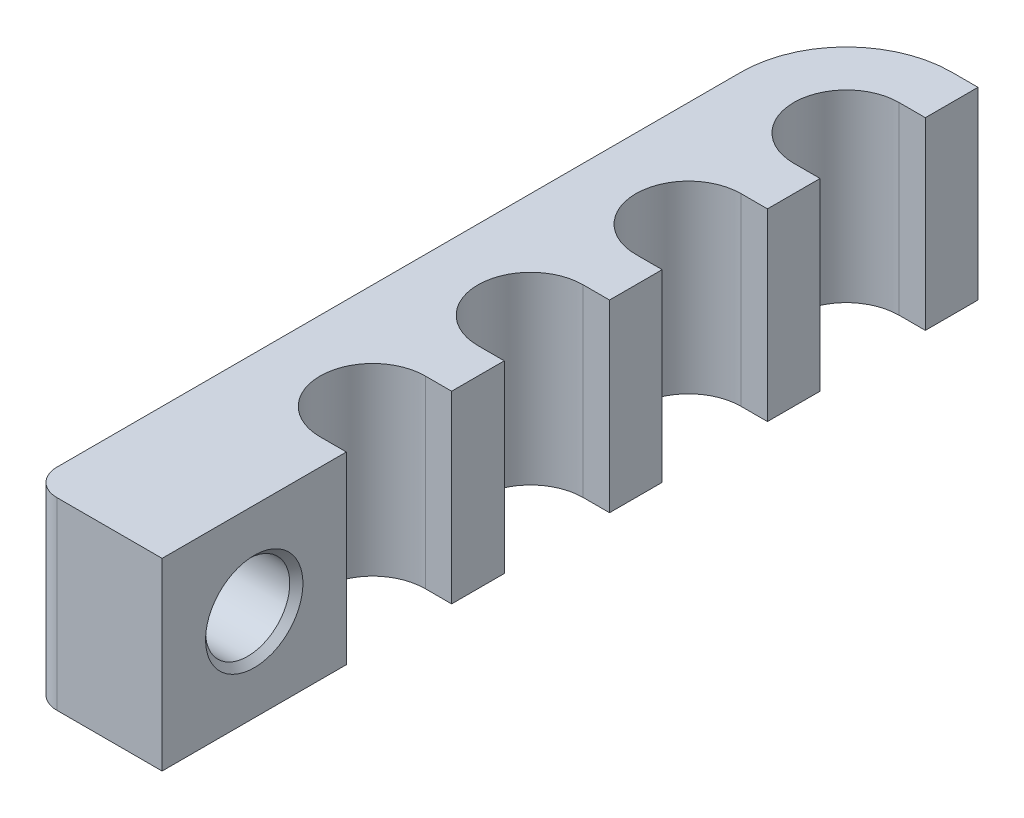
from build123d import *

# Parameters (mm, degrees)
BOSS_EXTRUDE1_DEPTH  = 7
M3_CLEARANCE_HOLE1_D = 3.2
CHAMFER2_SIZE        = 0.25
FILLET1_R            = 1


with BuildPart() as part:
    # Sketch1 → Boss-Extrude1 (new body)
    with BuildSketch(Plane(origin=(0, 0, 0), x_dir=(1, 0, 0), z_dir=(0, 1, 0))):
        with BuildLine():
            Line((0, 0), (-5, 0))
            Line((-5, 0), (-5, 9.065528002))
            Line((-5, 9.065528002), (-5, 27))
            ThreePointArc((-5, 27), (-3.828427125, 29.828427125), (-1, 31))
            Line((-1, 31), (0, 31))
            Line((0, 31), (0, 29))
            Line((0, 29), (-1, 29))
            ThreePointArc((-1, 29), (-3, 27), (-1, 25))
            Line((-1, 25), (0, 25))
            Line((0, 25), (0, 23))
            Line((0, 23), (-1, 23))
            ThreePointArc((-1, 23), (-3, 21), (-1, 19))
            Line((-1, 19), (0, 19))
            Line((0, 19), (0, 17))
            Line((0, 17), (-1, 17))
            ThreePointArc((-1, 17), (-3, 15), (-1, 13))
            Line((-1, 13), (0, 13))
            Line((0, 13), (0, 11))
            Line((0, 11), (-1, 11))
            ThreePointArc((-1, 11), (-3, 9), (-1, 7))
            Line((-1, 7), (0, 7))
            Line((0, 7), (0, 0))
        make_face()
    extrude(amount=BOSS_EXTRUDE1_DEPTH)

    # M3 Clearance Hole1 (through all)
    with Locations(Plane.ZY.offset(5)):
        with Locations((-3.5, 3.5)):
            Hole(M3_CLEARANCE_HOLE1_D / 2)

    # Chamfer2
    chamfer2_edges = [part.edges().sort_by_distance(p)[0] for p in [
        (-5, 3.5, -1.9),
        (0, 3.5, -1.9),
    ]]
    chamfer(chamfer2_edges, length=CHAMFER2_SIZE)

    # Fillet1
    fillet1_edges = [part.edges().sort_by_distance(p)[0] for p in [
        (-5, 3.5, 0),
    ]]
    fillet(fillet1_edges, radius=FILLET1_R)


solid = part.part
